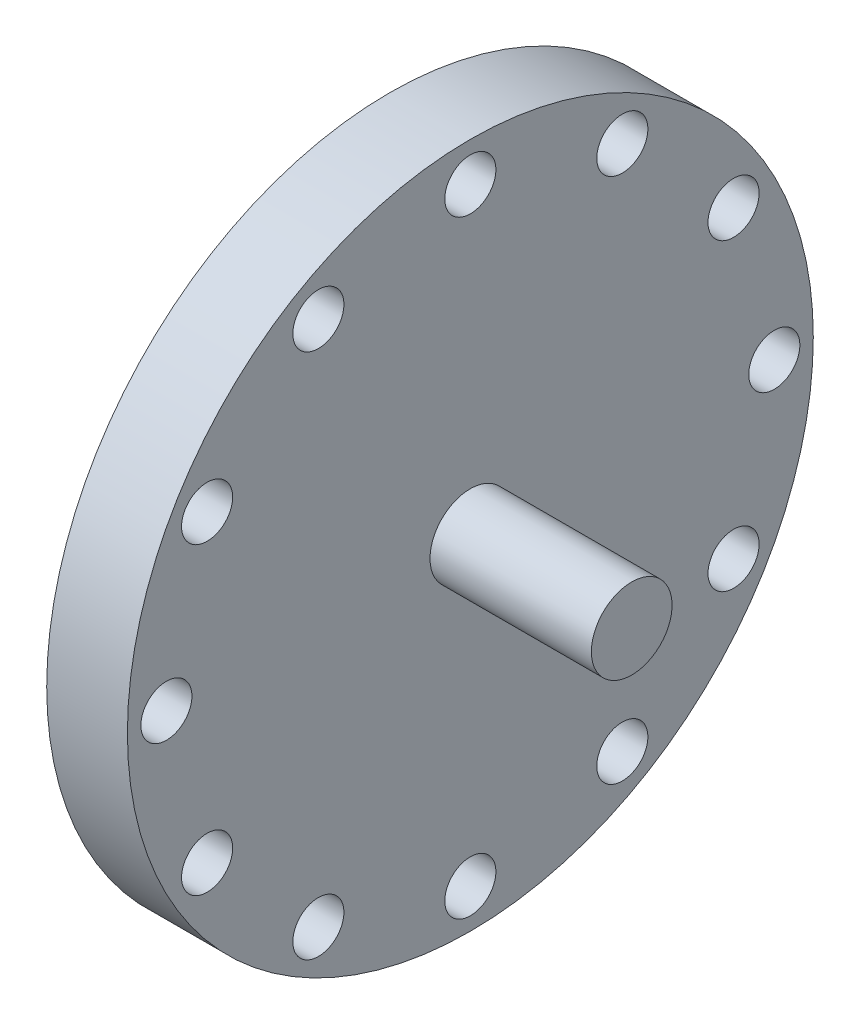
from build123d import *

# Parameters (mm, degrees)
SKETCH_2_R           = 9.5
CUT_EXTRUDE_1_DEPTH  = 207.185596005
SKETCH_3_R           = 9.5
CUT_EXTRUDE_2_DEPTH  = 207.185596005
SKETCH_4_R           = 9.5
CUT_EXTRUDE_3_DEPTH  = 207.185596005
SKETCH_5_R           = 9.5
CUT_EXTRUDE_4_DEPTH  = 207.185596005
SKETCH_6_R           = 9.5
CUT_EXTRUDE_5_DEPTH  = 207.185596005
SKETCH_7_R           = 9.5
CUT_EXTRUDE_6_DEPTH  = 207.185596005
SKETCH_8_R           = 9.5
CUT_EXTRUDE_7_DEPTH  = 207.185596005
SKETCH_9_R           = 9.5
CUT_EXTRUDE_8_DEPTH  = 207.185596005
SKETCH_10_R          = 9.5
CUT_EXTRUDE_9_DEPTH  = 207.185596005
SKETCH_11_R          = 9.5
CUT_EXTRUDE_10_DEPTH = 207.185596005
SKETCH_12_R          = 9.5
CUT_EXTRUDE_11_DEPTH = 207.185596005
SKETCH_13_R          = 9.5
CUT_EXTRUDE_12_DEPTH = 207.185596005


with BuildPart() as part:
    # Эскиз1 → Повернуть1 (revolve)
    with BuildSketch(Plane.XY, mode=Mode.PRIVATE) as revolve_1_sk:
        Polygon((0, 0), (100, 0), (100, 15), (40, 15), (40, 127.5), (10, 127.5), (10, 20), (0, 20), align=None)
    revolve(revolve_1_sk.sketch.rotate(Axis((0, 0, 0), (1, 0, 0)), 90), axis=Axis((0, 0, 0), (1, 0, 0)))

    # Эскиз2 → Вырез-Вытянуть1 (cut, through all)
    with BuildSketch(Plane(origin=(0, 0, 0), x_dir=(0, 0, -1), z_dir=(1, 0, 0))):
        with Locations(Location((0, 113, 0), (0, 0, 180))):
            Circle(SKETCH_2_R)
    extrude(amount=CUT_EXTRUDE_1_DEPTH, mode=Mode.SUBTRACT)

    # Эскиз3 → Вырез-Вытянуть2 (cut, through all)
    with BuildSketch(Plane(origin=(0, 0, 0), x_dir=(0, 0, -1), z_dir=(1, 0, 0))):
        with Locations(Location((-56.5, 97.860870628, 0), (0, 0, 180))):
            Circle(SKETCH_3_R)
    extrude(amount=CUT_EXTRUDE_2_DEPTH, mode=Mode.SUBTRACT)

    # Эскиз4 → Вырез-Вытянуть3 (cut, through all)
    with BuildSketch(Plane(origin=(0, 0, 0), x_dir=(0, 0, -1), z_dir=(1, 0, 0))):
        with Locations(Location((-97.860870628, 56.5, 0), (0, 0, 180))):
            Circle(SKETCH_4_R)
    extrude(amount=CUT_EXTRUDE_3_DEPTH, mode=Mode.SUBTRACT)

    # Эскиз5 → Вырез-Вытянуть4 (cut, through all)
    with BuildSketch(Plane(origin=(0, 0, 0), x_dir=(0, 0, -1), z_dir=(1, 0, 0))):
        with Locations(Location((-113, 0, 0), (0, 0, 180))):
            Circle(SKETCH_5_R)
    extrude(amount=CUT_EXTRUDE_4_DEPTH, mode=Mode.SUBTRACT)

    # Эскиз6 → Вырез-Вытянуть5 (cut, through all)
    with BuildSketch(Plane(origin=(0, 0, 0), x_dir=(0, 0, -1), z_dir=(1, 0, 0))):
        with Locations(Location((-97.860870628, -56.5, 0), (0, 0, 180))):
            Circle(SKETCH_6_R)
    extrude(amount=CUT_EXTRUDE_5_DEPTH, mode=Mode.SUBTRACT)

    # Эскиз7 → Вырез-Вытянуть6 (cut, through all)
    with BuildSketch(Plane(origin=(0, 0, 0), x_dir=(0, 0, -1), z_dir=(1, 0, 0))):
        with Locations(Location((-56.5, -97.860870628, 0), (0, 0, 180))):
            Circle(SKETCH_7_R)
    extrude(amount=CUT_EXTRUDE_6_DEPTH, mode=Mode.SUBTRACT)

    # Эскиз8 → Вырез-Вытянуть7 (cut, through all)
    with BuildSketch(Plane(origin=(0, 0, 0), x_dir=(0, 0, -1), z_dir=(1, 0, 0))):
        with Locations(Location((0, -113, 0), (0, 0, 180))):
            Circle(SKETCH_8_R)
    extrude(amount=CUT_EXTRUDE_7_DEPTH, mode=Mode.SUBTRACT)

    # Эскиз9 → Вырез-Вытянуть8 (cut, through all)
    with BuildSketch(Plane(origin=(0, 0, 0), x_dir=(0, 0, -1), z_dir=(1, 0, 0))):
        with Locations(Location((56.5, -97.860870628, 0), (0, 0, 180))):
            Circle(SKETCH_9_R)
    extrude(amount=CUT_EXTRUDE_8_DEPTH, mode=Mode.SUBTRACT)

    # Эскиз10 → Вырез-Вытянуть9 (cut, through all)
    with BuildSketch(Plane(origin=(0, 0, 0), x_dir=(0, 0, -1), z_dir=(1, 0, 0))):
        with Locations(Location((97.860870628, -56.5, 0), (0, 0, 180))):
            Circle(SKETCH_10_R)
    extrude(amount=CUT_EXTRUDE_9_DEPTH, mode=Mode.SUBTRACT)

    # Эскиз11 → Вырез-Вытянуть10 (cut, through all)
    with BuildSketch(Plane(origin=(0, 0, 0), x_dir=(0, 0, -1), z_dir=(1, 0, 0))):
        with Locations(Location((113, 0, 0), (0, 0, 180))):
            Circle(SKETCH_11_R)
    extrude(amount=CUT_EXTRUDE_10_DEPTH, mode=Mode.SUBTRACT)

    # Эскиз12 → Вырез-Вытянуть11 (cut, through all)
    with BuildSketch(Plane(origin=(0, 0, 0), x_dir=(0, 0, -1), z_dir=(1, 0, 0))):
        with Locations(Location((97.860870628, 56.5, 0), (0, 0, 180))):
            Circle(SKETCH_12_R)
    extrude(amount=CUT_EXTRUDE_11_DEPTH, mode=Mode.SUBTRACT)

    # Эскиз13 → Вырез-Вытянуть12 (cut, through all)
    with BuildSketch(Plane(origin=(0, 0, 0), x_dir=(0, 0, -1), z_dir=(1, 0, 0))):
        with Locations(Location((56.5, 97.860870628, 0), (0, 0, 180))):
            Circle(SKETCH_13_R)
    extrude(amount=CUT_EXTRUDE_12_DEPTH, mode=Mode.SUBTRACT)


solid = part.part
